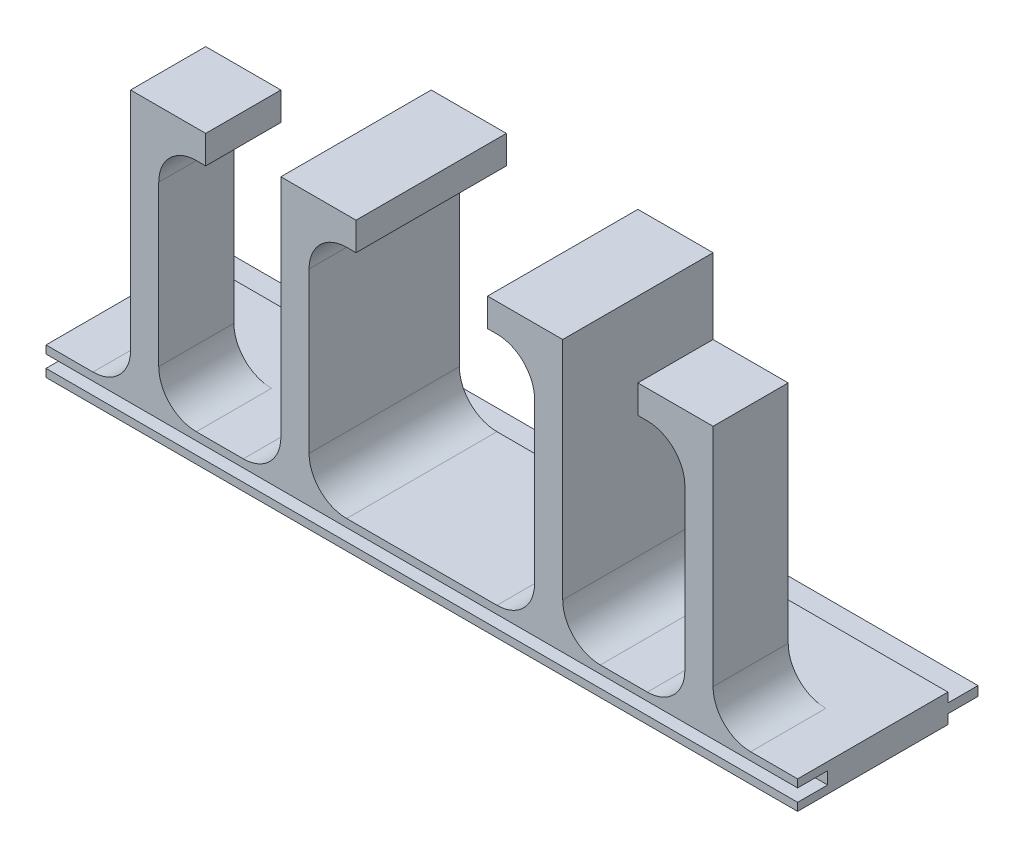
from build123d import *

# Parameters (mm, degrees)
SKETCH1_W            = 127
SKETCH1_H            = 25.4
BOSS_EXTRUDE1_DEPTH  = 4.7625
SKETCH2_W            = 4.7625
SKETCH2_H            = 25.4
SKETCH2_H_2          = 12.7
BOSS_EXTRUDE2_DEPTH  = 44.45
SKETCH3_W            = 25.4
SKETCH3_H            = 4.7625
BOSS_EXTRUDE3_DEPTH  = 7.9375
SKETCH4_W            = 12.7
SKETCH4_H            = 4.7625
BOSS_EXTRUDE4_DEPTH  = 7.9375
FILLET1_R            = 6.35
FILLET1_OF_MIRROR1_R = 6.35
SKETCH5_W            = 127
SKETCH5_H            = 2.0955
CUT_EXTRUDE1_DEPTH   = 5.08
SKETCH6_W            = 127
SKETCH6_H            = 1.5875
BOSS_EXTRUDE5_DEPTH  = 5.08


with BuildPart() as part:
    # Sketch1 → Boss-Extrude1 (new body)
    with BuildSketch(Plane(origin=(0, 0, 0), x_dir=(1, 0, 0), z_dir=(0, 1, 0))):
        with Locations((63.5, 12.7)):
            Rectangle(SKETCH1_W, SKETCH1_H)
    extrude(amount=BOSS_EXTRUDE1_DEPTH)

    # Sketch2 → Boss-Extrude2 (add)
    with BuildSketch(Plane(origin=(0, 4.7625, 0), x_dir=(1, 0, 0), z_dir=(0, 1, 0))):
        with Locations((42.06875, 12.7)):
            Rectangle(SKETCH2_W, SKETCH2_H)
        with Locations((16.66875, 6.35)):
            Rectangle(SKETCH2_W, SKETCH2_H_2)
    boss_extrude2 = extrude(amount=BOSS_EXTRUDE2_DEPTH)

    # Sketch3 → Boss-Extrude3 (add)
    with BuildSketch(Plane(origin=(44.45, 0, 0), x_dir=(0, 0, -1), z_dir=(1, 0, 0))):
        with Locations((12.7, 46.83125)):
            Rectangle(SKETCH3_W, SKETCH3_H)
    boss_extrude3 = extrude(amount=BOSS_EXTRUDE3_DEPTH)

    # Sketch4 → Boss-Extrude4 (add)
    with BuildSketch(Plane(origin=(19.05, 0, 0), x_dir=(0, 0, -1), z_dir=(1, 0, 0))):
        with Locations((6.35, 46.83125)):
            Rectangle(SKETCH4_W, SKETCH4_H)
    boss_extrude4 = extrude(amount=BOSS_EXTRUDE4_DEPTH)

    # Fillet1
    fillet1_edges = [part.edges().sort_by_distance(p)[0] for p in [
        (39.6875, 4.7625, -12.7),
        (44.45, 4.7625, -12.7),
        (19.05, 4.7625, -6.35),
        (14.2875, 4.7625, -6.35),
        (44.45, 44.45, -12.7),
        (19.05, 44.45, -6.35),
    ]]
    fillet(fillet1_edges, radius=FILLET1_R)

    # Mirror1: Boss-Extrude2, Boss-Extrude3, Boss-Extrude4 across plane
    add(boss_extrude2.mirror(Plane(origin=(63.5, 0, 0), x_dir=(0, 0, 1), z_dir=(1, 0, 0))))
    add(boss_extrude3.mirror(Plane(origin=(63.5, 0, 0), x_dir=(0, 0, 1), z_dir=(1, 0, 0))))
    add(boss_extrude4.mirror(Plane(origin=(63.5, 0, 0), x_dir=(0, 0, 1), z_dir=(1, 0, 0))))

    # Fillet1 of Mirror1
    fillet1_of_mirror1_edges = [part.edges().sort_by_distance(p)[0] for p in [
        (87.3125, 4.7625, -12.7),
        (82.55, 4.7625, -12.7),
        (107.95, 4.7625, -6.35),
        (112.7125, 4.7625, -6.35),
        (82.55, 44.45, -12.7),
        (107.95, 44.45, -6.35),
    ]]
    fillet(fillet1_of_mirror1_edges, radius=FILLET1_OF_MIRROR1_R)

    # Sketch5 → Cut-Extrude1 (cut)
    with BuildSketch(Plane.XY):
        with Locations((63.5, 2.38125)):
            Rectangle(SKETCH5_W, SKETCH5_H)
    extrude(amount=-CUT_EXTRUDE1_DEPTH, mode=Mode.SUBTRACT)

    # Sketch6 → Boss-Extrude5 (add)
    with BuildSketch(Plane(origin=(0, 0, -25.4), x_dir=(-1, 0, 0), z_dir=(0, 0, -1))):
        with Locations((-63.5, 2.38125)):
            Rectangle(SKETCH6_W, SKETCH6_H)
    extrude(amount=BOSS_EXTRUDE5_DEPTH)


solid = part.part
